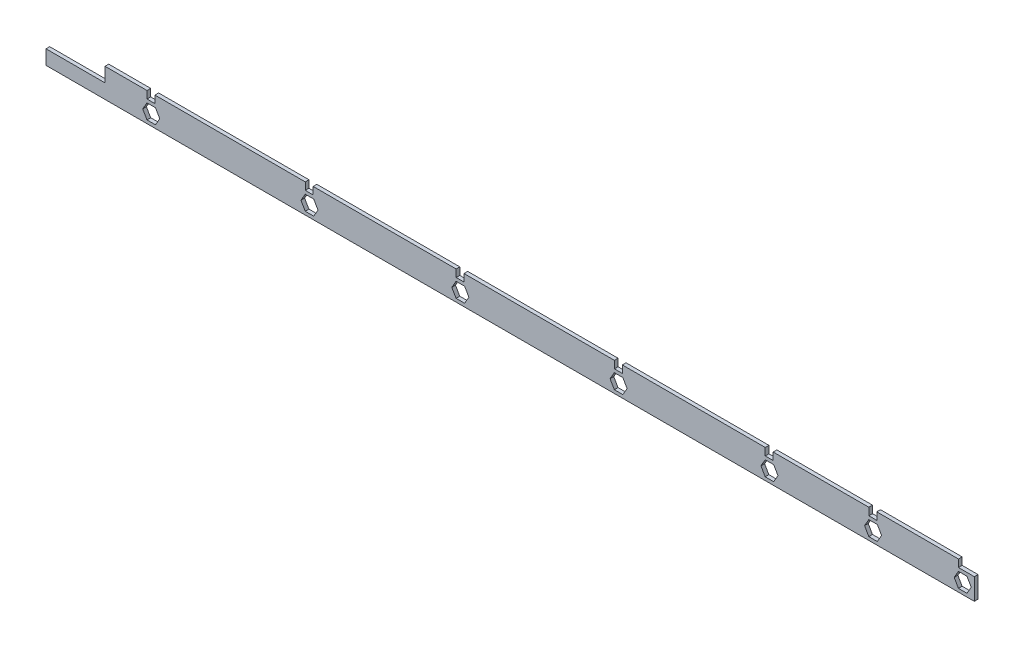
from build123d import *

# Parameters (mm, degrees)
BOSS_EXTRUDE1_DEPTH = 1.5875


with BuildPart() as part:
    # Sketch1 → Boss-Extrude1 (new body)
    with BuildSketch(Plane.XY):
        Polygon((6838.872739, 2682.026941165), (6838.872739, 2685.201941165), (6803.727441916, 2685.201941165), (6803.727441916, 2682.026941165), (6800.323841916, 2682.026941165), (6800.323841916, 2685.201941165), (6759.161189, 2685.201941165), (6759.161189, 2682.026941165), (6755.757589, 2682.026941165), (6755.757589, 2685.201941165), (6694.276889, 2685.201941165), (6694.276889, 2682.026941165), (6690.873289, 2682.026941165), (6690.873289, 2685.201941165), (6626.217589, 2685.201941165), (6626.217589, 2682.026941165), (6622.813989, 2682.026941165), (6622.813989, 2685.201941165), (6561.333289, 2685.201941165), (6561.333289, 2682.026941165), (6557.929689, 2682.026941165), (6557.929689, 2685.201941165), (6493.273989, 2685.201941165), (6493.273989, 2682.026941165), (6489.870389, 2682.026941165), (6489.870389, 2685.201941165), (6471.830039, 2685.201941165), (6471.830039, 2679.017041165), (6446.430039, 2679.017041165), (6446.430039, 2672.832141165), (6845.679939, 2672.832141165), (6845.679939, 2682.026941165), align=None)
        Polygon((6493.519576105, 2674.254541165), (6495.35266321, 2677.429541165), (6493.519576105, 2680.604541165), (6489.853401896, 2680.604541165), (6488.020314791, 2677.429541165), (6489.853401896, 2674.254541165), align=None, mode=Mode.SUBTRACT)
        Polygon((6561.578876105, 2674.254541165), (6563.41196321, 2677.429541165), (6561.578876105, 2680.604541165), (6557.912701896, 2680.604541165), (6556.079614791, 2677.429541165), (6557.912701896, 2674.254541165), align=None, mode=Mode.SUBTRACT)
        Polygon((6626.463176105, 2674.254541165), (6628.29626321, 2677.429541165), (6626.463176105, 2680.604541165), (6622.797001896, 2680.604541165), (6620.963914791, 2677.429541165), (6622.797001896, 2674.254541165), align=None, mode=Mode.SUBTRACT)
        Polygon((6694.522476105, 2674.254541165), (6696.35556321, 2677.429541165), (6694.522476105, 2680.604541165), (6690.856301896, 2680.604541165), (6689.023214791, 2677.429541165), (6690.856301896, 2674.254541165), align=None, mode=Mode.SUBTRACT)
        Polygon((6759.406776105, 2674.254541165), (6761.23986321, 2677.429541165), (6759.406776105, 2680.604541165), (6755.740601896, 2680.604541165), (6753.907514791, 2677.429541165), (6755.740601896, 2674.254541165), align=None, mode=Mode.SUBTRACT)
        Polygon((6803.973029021, 2674.254541165), (6805.806116126, 2677.429541165), (6803.973029021, 2680.604541165), (6800.306854812, 2680.604541165), (6798.473767707, 2677.429541165), (6800.306854812, 2674.254541165), align=None, mode=Mode.SUBTRACT)
        Polygon((6842.521926105, 2674.254541165), (6844.35501321, 2677.429541165), (6842.521926105, 2680.604541165), (6838.855751896, 2680.604541165), (6837.022664791, 2677.429541165), (6838.855751896, 2674.254541165), align=None, mode=Mode.SUBTRACT)
    extrude(amount=BOSS_EXTRUDE1_DEPTH)


solid = part.part
